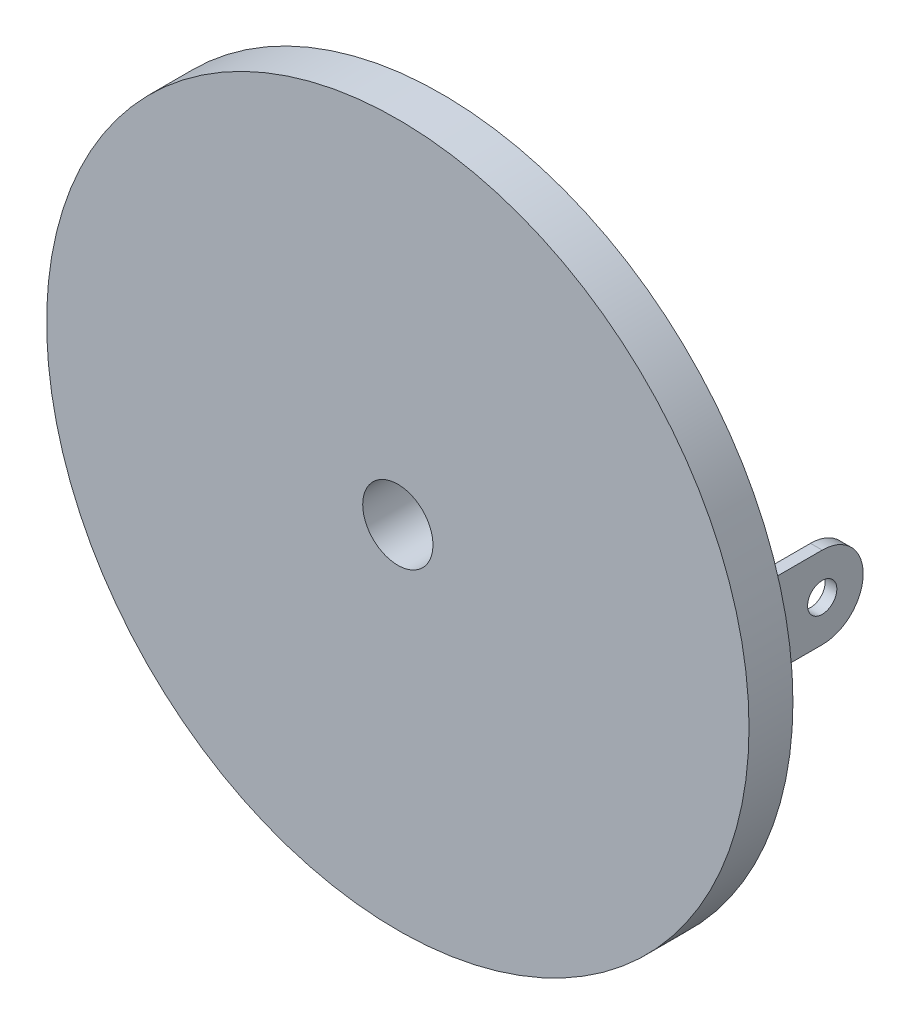
from build123d import *

# Parameters (mm, degrees)
ESQUISSE1_R             = 12
EXTRUSION1_DEPTH        = 1.5
ESQUISSE2_W             = 0.4
ESQUISSE2_H             = 2.8
EXTRUSION2_DEPTH        = 5
ESQUISSE3_R             = 4.2
EXTRUSION3_DEPTH        = 2
ESQUISSE4_R             = 0.5
ENL_V_MAT_EXTRU_1_DEPTH = 26.039169315
ESQUISSE5_R             = 1.2
ENL_V_MAT_EXTRU_2_DEPTH = 18.327723451


with BuildPart() as part:
    # Esquisse1 → Extrusion1 (new body)
    with BuildSketch(Plane.XY):
        Circle(ESQUISSE1_R)
    extrude(amount=EXTRUSION1_DEPTH)

    # Esquisse2 → Extrusion2 (add)
    with BuildSketch(Plane(origin=(0, 0, 0), x_dir=(-1, 0, 0), z_dir=(0, 0, -1))):
        with Locations((9.2, 0)):
            Rectangle(ESQUISSE2_W, ESQUISSE2_H)
        with Locations((-9.2, 0)):
            Rectangle(ESQUISSE2_W, ESQUISSE2_H)
    extrude(amount=EXTRUSION2_DEPTH)

    # Esquisse3 → Extrusion3 (add)
    with BuildSketch(Plane(origin=(0, 0, 0), x_dir=(-1, 0, 0), z_dir=(0, 0, -1))):
        with Locations(Location((0, 0, 0), (0, 0, 180))):
            Circle(ESQUISSE3_R)
    extrude(amount=EXTRUSION3_DEPTH)

    # Esquisse4 → Enlèv. mat.-Extru.1 (cut, through all)
    with BuildSketch(Plane(origin=(9.4, 0, 0), x_dir=(0, 0, -1), z_dir=(1, 0, 0))):
        with Locations((3.6, 0)):
            Circle(ESQUISSE4_R)
        with BuildLine():
            Line((3.6, 1.4), (3.6, 1.511382549))
            Line((3.6, 1.511382549), (5.122212009, 1.511382549))
            Line((5.122212009, 1.511382549), (5.122212009, -1.492036709))
            Line((5.122212009, -1.492036709), (3.6, -1.492036709))
            Line((3.6, -1.492036709), (3.6, -1.4))
            ThreePointArc((3.6, -1.4), (5, 0), (3.6, 1.4))
        make_face()
    extrude(amount=-ENL_V_MAT_EXTRU_1_DEPTH, mode=Mode.SUBTRACT)

    # Esquisse5 → Enlèv. mat.-Extru.2 (cut, through all)
    with BuildSketch(Plane(origin=(0, 0, -2), x_dir=(-1, 0, 0), z_dir=(0, 0, -1))):
        Circle(ESQUISSE5_R)
    extrude(amount=-ENL_V_MAT_EXTRU_2_DEPTH, mode=Mode.SUBTRACT)


solid = part.part
